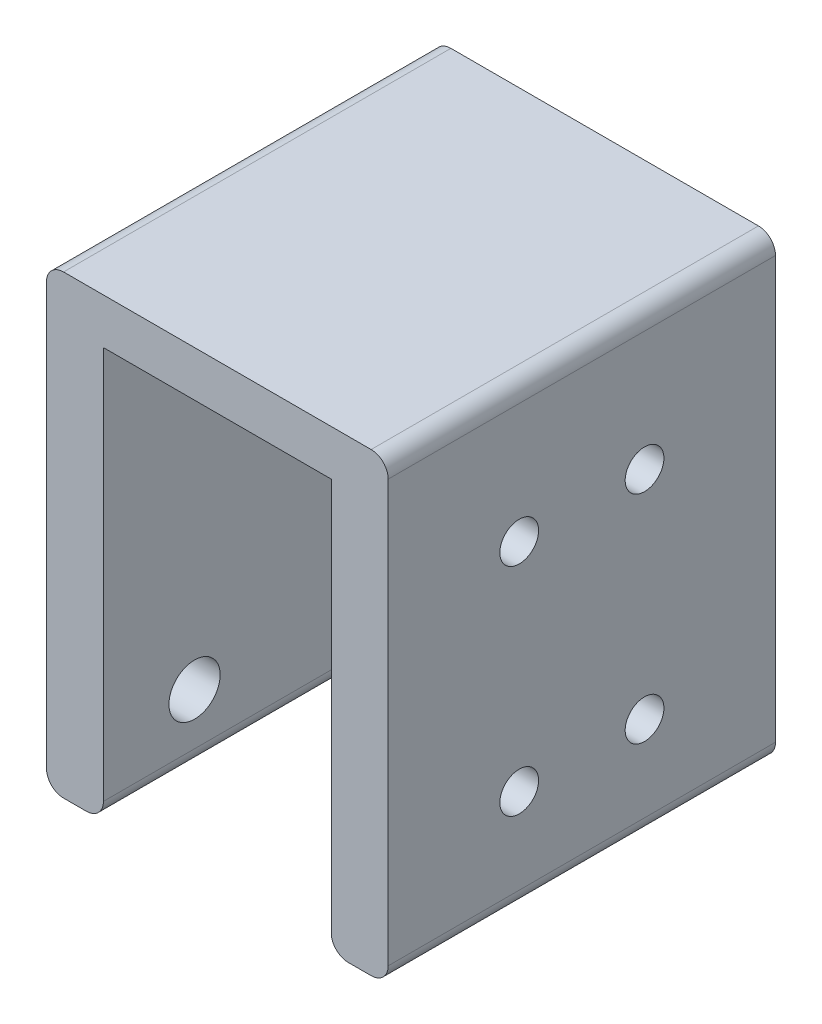
from build123d import *

# Parameters (mm, degrees)
SKETCH_1_W          = 34
SKETCH_1_H          = 40
SKETCH_1_R          = 2.25
EXTRUDE_1_DEPTH     = 5
SKETCH_2_W          = 34
SKETCH_2_H          = 4
EXTRUDE_2_DEPTH     = 20
SKETCH_3_W          = 34
SKETCH_3_H          = 40
EXTRUDE_3_DEPTH     = 5
SKETCH_4_R          = 1.7
CUT_EXTRUDE_1_DEPTH = 5
FILLET_1_R          = 1.5


with BuildPart() as part:
    # 草图1 → 凸台-拉伸1 (new body)
    with BuildSketch(Plane(origin=(0, 0, 0), x_dir=(0, 0, -1), z_dir=(1, 0, 0))):
        with Locations((17, 20)):
            Rectangle(SKETCH_1_W, SKETCH_1_H)
        with Locations((8, 32)):
            Circle(SKETCH_1_R, mode=Mode.SUBTRACT)
        with Locations((8, 6)):
            Circle(SKETCH_1_R, mode=Mode.SUBTRACT)
        with Locations((26, 32)):
            Circle(SKETCH_1_R, mode=Mode.SUBTRACT)
        with Locations((26, 6)):
            Circle(SKETCH_1_R, mode=Mode.SUBTRACT)
    extrude(amount=EXTRUDE_1_DEPTH)

    # 草图2 → 凸台-拉伸2 (add)
    with BuildSketch(Plane(origin=(5, 0, 0), x_dir=(0, 0, -1), z_dir=(1, 0, 0))):
        with Locations((17, 38)):
            Rectangle(SKETCH_2_W, SKETCH_2_H)
    extrude(amount=EXTRUDE_2_DEPTH)

    # 草图3 → 凸台-拉伸3 (add)
    with BuildSketch(Plane(origin=(25, 0, 0), x_dir=(0, 0, -1), z_dir=(1, 0, 0))):
        with Locations((17, 20)):
            Rectangle(SKETCH_3_W, SKETCH_3_H)
    extrude(amount=EXTRUDE_3_DEPTH)

    # 草图4 → 切除-拉伸1 (cut)
    with BuildSketch(Plane(origin=(30, 0, 0), x_dir=(0, 0, -1), z_dir=(1, 0, 0))):
        with Locations((11.5, 28)):
            Circle(SKETCH_4_R)
        with Locations((22.5, 28)):
            Circle(SKETCH_4_R)
        with Locations((11.5, 9)):
            Circle(SKETCH_4_R)
        with Locations((22.5, 9)):
            Circle(SKETCH_4_R)
    extrude(amount=-CUT_EXTRUDE_1_DEPTH, mode=Mode.SUBTRACT)

    # 圆角1
    fillet_1_edges = [part.edges().sort_by_distance(p)[0] for p in [
        (25, 0, -17),
        (30, 0, -17),
        (30, 40, -17),
        (0, 40, -17),
        (0, 0, -17),
        (5, 0, -17),
    ]]
    fillet(fillet_1_edges, radius=FILLET_1_R)


solid = part.part
